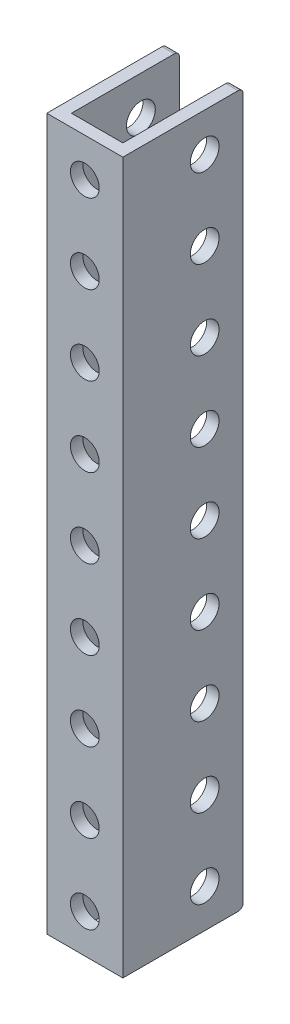
from build123d import *

# Parameters (mm, degrees)
SKETCH1_W                 = 87.757
SKETCH1_H                 = 14.859
BOSS_EXTRUDE1_DEPTH       = 9.398
SKETCH2_W                 = 6.35
SKETCH2_H                 = 13.335
CUT_EXTRUDE1_DEPTH        = 89.888659991
F_5_CLEARANCE_HOLE1_D     = 3.556
F_5_CLEARANCE_HOLE1_DEPTH = 1.524
F_5_CLEARANCE_HOLE2_D     = 3.556
F_5_CLEARANCE_HOLE2_DEPTH = 14.859
F_5_CLEARANCE_HOLE3_D     = 3.556
FILLET1_R                 = 0.635


with BuildPart() as part:
    # Sketch1 → Boss-Extrude1 (new body)
    with BuildSketch(Plane(origin=(-4.699, 0, 0), x_dir=(0, -1, 0), z_dir=(-1, 0, 0))):
        with Locations((-43.8785, -5.9055)):
            Rectangle(SKETCH1_W, SKETCH1_H)
    extrude(amount=-BOSS_EXTRUDE1_DEPTH)

    # Sketch2 → Cut-Extrude1 (cut, through all)
    with BuildSketch(Plane.XZ):
        with Locations((0, -6.6675)):
            Rectangle(SKETCH2_W, SKETCH2_H)
    extrude(amount=-CUT_EXTRUDE1_DEPTH, mode=Mode.SUBTRACT)

    # #5 Clearance Hole1
    with Locations(Plane(origin=(4.699, 0, 0), x_dir=(0, 0, -1), z_dir=(1, 0, 0))):
        with Locations((8.5725, 73.2155), (8.5725, 82.9945), (8.5725, 63.4365), (8.5725, 53.6575), (8.5725, 43.8785), (8.5725, 34.0995), (8.5725, 24.3205), (8.5725, 14.5415), (8.5725, 4.7625)):
            Hole(F_5_CLEARANCE_HOLE1_D / 2, depth=F_5_CLEARANCE_HOLE1_DEPTH)

    # #5 Clearance Hole2
    with Locations(Plane.XY.offset(1.524)):
        with Locations((0, 73.2155), (0, 82.9945), (0, 63.4365), (0, 53.6575), (0, 43.8785), (0, 34.0995), (0, 24.3205), (0, 14.5415), (0, 4.7625)):
            Hole(F_5_CLEARANCE_HOLE2_D / 2, depth=F_5_CLEARANCE_HOLE2_DEPTH)

    # #5 Clearance Hole3 (through all)
    with Locations(Plane(origin=(-3.175, 0, 0), x_dir=(0, 0, -1), z_dir=(1, 0, 0))):
        with Locations((8.5725, 73.2155), (8.5725, 82.9945), (8.5725, 63.4365), (8.5725, 53.6575), (8.5725, 43.8785), (8.5725, 34.0995), (8.5725, 24.3205), (8.5725, 14.5415), (8.5725, 4.7625)):
            Hole(F_5_CLEARANCE_HOLE3_D / 2)

    # Fillet1
    fillet1_edges = [part.edges().sort_by_distance(p)[0] for p in [
        (-3.937, 87.757, -13.335),
        (-3.937, 0, -13.335),
        (3.937, 0, -13.335),
        (3.937, 87.757, -13.335),
    ]]
    fillet(fillet1_edges, radius=FILLET1_R)


solid = part.part
